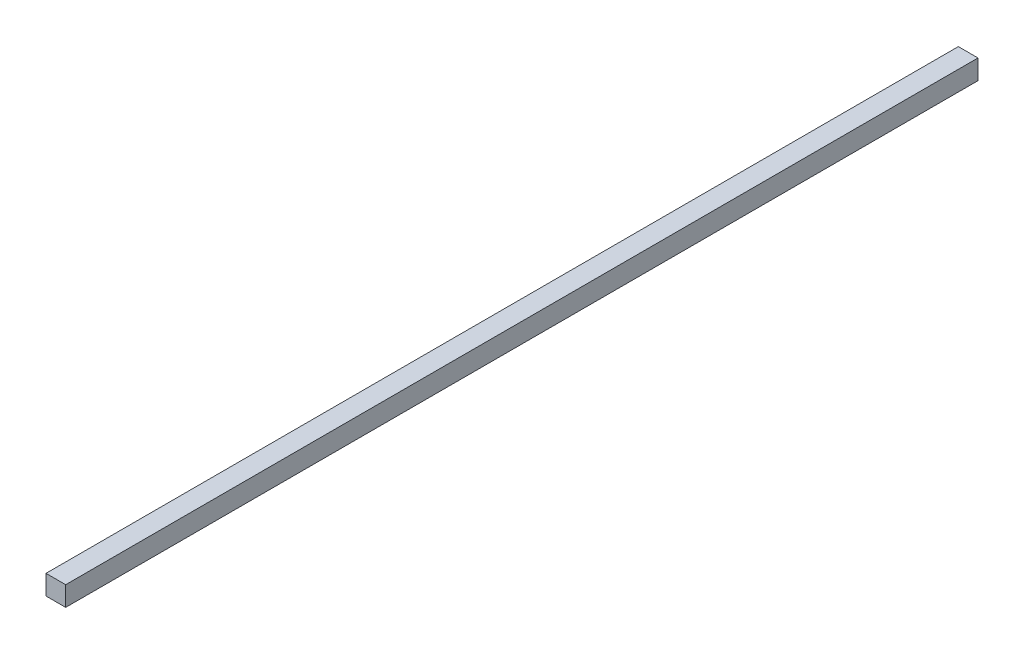
from build123d import *

# Parameters (mm, degrees)
SKETCH1_W           = 4.8
SKETCH1_H           = 4.8
BOSS_EXTRUDE1_DEPTH = 222.5


with BuildPart() as part:
    # Sketch1 → Boss-Extrude1 (new body)
    with BuildSketch(Plane.XY):
        with Locations((2.4, 2.4)):
            Rectangle(SKETCH1_W, SKETCH1_H)
    extrude(amount=BOSS_EXTRUDE1_DEPTH)


solid = part.part
